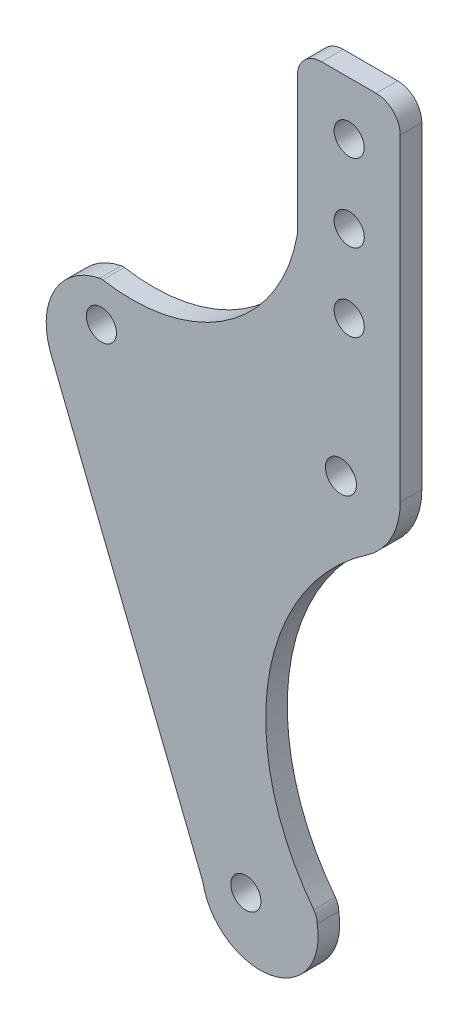
from build123d import *

# Parameters (mm, degrees)
SKETCH1_R           = 2.2225
BOSS_EXTRUDE1_DEPTH = 3.175
SKETCH2_R           = 2.286
CUT_EXTRUDE1_DEPTH  = 111.684893933


with BuildPart() as part:
    # Sketch1 → Boss-Extrude1 (new body)
    with BuildSketch(Plane.XY):
        with BuildLine():
            Line((-26.682968963, 26.357722587), (-26.682968963, 6.351785872))
            ThreePointArc((-26.682968963, 6.351785872), (-26.693527307, 6.120431356), (-26.725114563, 5.891000243))
            ThreePointArc((-26.725114563, 5.891000243), (-36.932915208, -9.945248539), (-55.328203965, -14.019474973))
            ThreePointArc((-55.328203965, -14.019474973), (-55.554473877, -14.001365453), (-55.780223055, -14.025100158))
            ThreePointArc((-55.780223055, -14.025100158), (-62.402560981, -18.816713415), (-63.103372405, -26.960654757))
            Line((-63.103372405, -26.960654757), (-40.595944625, -83.455943866))
            ThreePointArc((-40.595944625, -83.455943866), (-30.641352377, -90.339421853), (-23.75787439, -80.384829605))
            ThreePointArc((-23.75787439, -80.384829605), (-23.88583974, -79.549342433), (-24.280867854, -78.802103023))
            ThreePointArc((-24.280867854, -78.802103023), (-30.912062559, -52.492603109), (-16.357010265, -29.594721511))
            ThreePointArc((-16.357010265, -29.594721511), (-12.809669567, -25.627558214), (-11.528139151, -20.46231955))
            Line((-11.528139151, -20.46231955), (-11.528139151, 26.357722587))
            ThreePointArc((-11.528139151, 26.357722587), (-12.569667438, 28.872194301), (-15.084139151, 29.913722587))
            Line((-15.084139151, 29.913722587), (-23.126968963, 29.913722587))
            ThreePointArc((-23.126968963, 29.913722587), (-25.641440677, 28.872194301), (-26.682968963, 26.357722587))
        make_face()
        with Locations((-55.544078679, -19.824964902)):
            Circle(SKETCH1_R, mode=Mode.SUBTRACT)
        with Locations((-19.05, 22.084955235)):
            Circle(SKETCH1_R, mode=Mode.SUBTRACT)
        with Locations((-19.05, -0.775044765)):
            Circle(SKETCH1_R, mode=Mode.SUBTRACT)
        with Locations((-34.268702177, -81.651111456)):
            Circle(SKETCH1_R, mode=Mode.SUBTRACT)
        with Locations((-19.05, 10.654955235)):
            Circle(SKETCH1_R, mode=Mode.SUBTRACT)
    extrude(amount=BOSS_EXTRUDE1_DEPTH)

    # Sketch2 → Cut-Extrude1 (cut, through all)
    with BuildSketch(Plane.XY.offset(3.175)):
        with Locations((-20.267510202, -21.516890861)):
            Circle(SKETCH2_R)
    extrude(amount=-CUT_EXTRUDE1_DEPTH, mode=Mode.SUBTRACT)


solid = part.part
